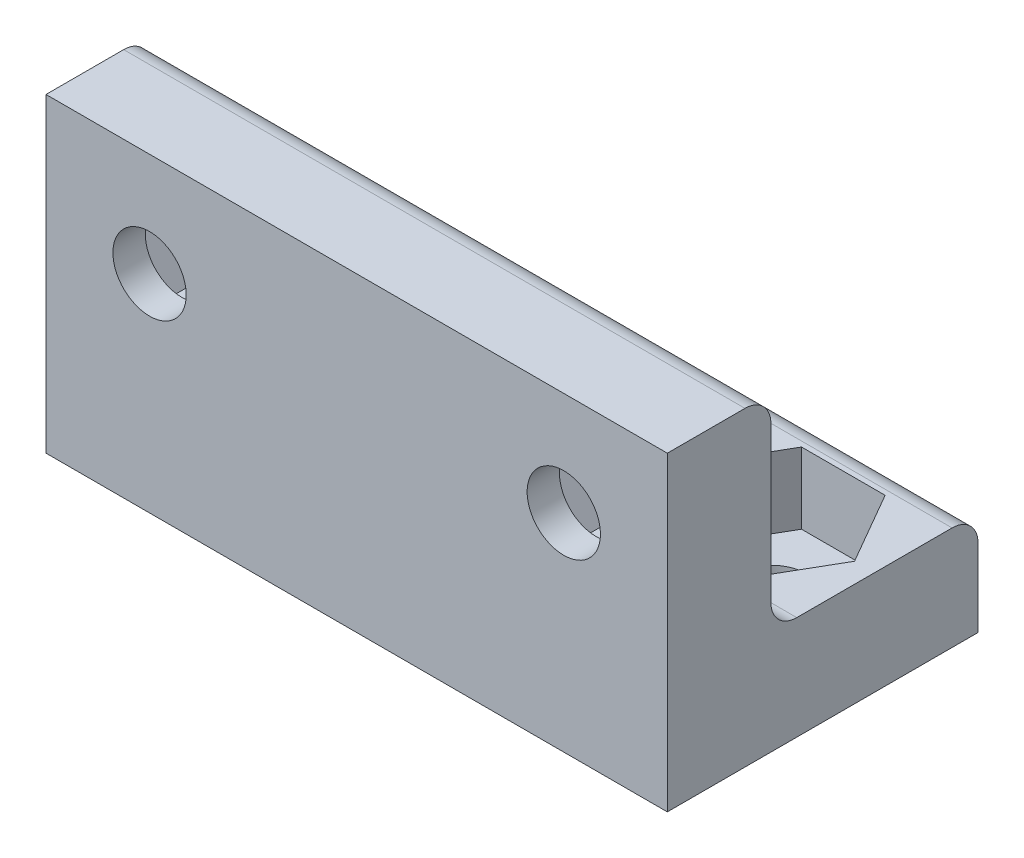
from build123d import *

# Parameters (mm, degrees)
BOSS_EXTRUDE1_DEPTH = 19.05
SKETCH2_R           = 2.2479
CUT_EXTRUDE1_DEPTH  = 4.365625
SKETCH2_2_R         = 2.2479
CUT_EXTRUDE2_DEPTH  = 28.679008291
FILLET1_R           = 1.5875
FILLET2_R           = 1.5875


with BuildPart() as part:
    # Sketch1 → Boss-Extrude1 (new, symmetric)
    with BuildSketch(Plane(origin=(0, 0, 0), x_dir=(0, 0, -1), z_dir=(1, 0, 0))):
        Polygon((0, 0), (6.35, 6.35), (19.05, 6.35), (19.05, 0), align=None)
    extrude(amount=BOSS_EXTRUDE1_DEPTH, both=True)

    # Sketch2 → Cut-Extrude1 (cut)
    # profile 1 of 2: a face of its own
    with BuildSketch(Plane(origin=(0, 6.35, 0), x_dir=(1, 0, 0), z_dir=(0, 1, 0))):
        Polygon((-17.828977719, 12.7), (-15.264488859, 8.258175), (-10.135511141, 8.258175), (-7.571022281, 12.7), (-10.135511141, 17.141825), (-15.264488859, 17.141825), align=None)
        with Locations((-12.7, 12.7)):
            Circle(SKETCH2_R, mode=Mode.SUBTRACT)
    # profile 2 of 2: a face of its own
    with BuildSketch(Plane(origin=(0, 6.35, 0), x_dir=(1, 0, 0), z_dir=(0, 1, 0))):
        Polygon((15.264488859, 17.141825), (17.828977719, 12.7), (15.264488859, 8.258175), (10.135511141, 8.258175), (7.571022281, 12.7), (10.135511141, 17.141825), align=None)
        with Locations((12.7, 12.7)):
            Circle(SKETCH2_R, mode=Mode.SUBTRACT)
    extrude(amount=-CUT_EXTRUDE1_DEPTH, mode=Mode.SUBTRACT)

    # Sketch2<2> → Cut-Extrude2 (cut, through all)
    with BuildSketch(Plane(origin=(0, 6.35, 0), x_dir=(1, 0, 0), z_dir=(0, 1, 0))):
        with Locations((-12.7, 12.7)):
            Circle(SKETCH2_2_R)
        with Locations((12.7, 12.7)):
            Circle(SKETCH2_2_R)
    extrude(amount=-CUT_EXTRUDE2_DEPTH, mode=Mode.SUBTRACT)

    # Mirror1: part across plane


with BuildPart() as part_1:
    add(part.part)
    add(part.part.mirror(Plane(origin=(19.05, 0, 0), x_dir=(0, -0.707106781186549, 0.707106781186546), z_dir=(0, -0.7071067811865462, -0.7071067811865489))))

    # Fillet1
    fillet1_edges = [part_1.edges().sort_by_distance(p)[0] for p in [
        (0, 6.35, -6.35),
    ]]
    fillet(fillet1_edges, radius=FILLET1_R)

    # Fillet2
    fillet2_edges = [part_1.edges().sort_by_distance(p)[0] for p in [
        (0, 6.35, -19.05),
        (0, 19.05, -6.35),
    ]]
    fillet(fillet2_edges, radius=FILLET2_R)


solid = part_1.part
